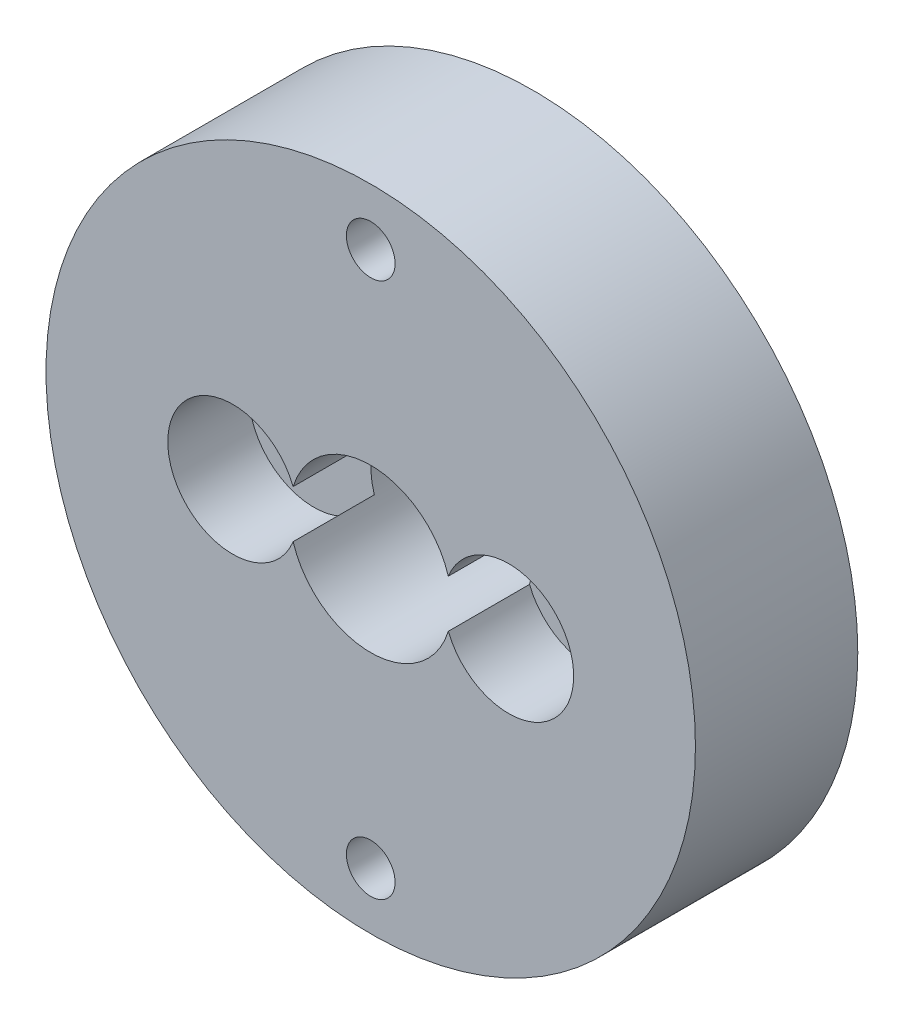
from build123d import *

# Parameters (mm, degrees)
SKETCH1_R           = 20
SKETCH1_R_2         = 1.25
SKETCH1_R_3         = 5
SKETCH1_R_4         = 1.5
BOSS_EXTRUDE1_DEPTH = 10
SKETCH2_R           = 4
CUT_EXTRUDE1_DEPTH  = 5


with BuildPart() as part:
    # Sketch1 → Boss-Extrude1 (new body)
    with BuildSketch(Plane.XY):
        Circle(SKETCH1_R)
        with Locations((-8.5, 0)):
            Circle(SKETCH1_R_2, mode=Mode.SUBTRACT)
        with Locations((8.5, 0)):
            Circle(SKETCH1_R_2, mode=Mode.SUBTRACT)
        Circle(SKETCH1_R_3, mode=Mode.SUBTRACT)
        with Locations((0, 16.5)):
            Circle(SKETCH1_R_4, mode=Mode.SUBTRACT)
        with Locations((0, -16.5)):
            Circle(SKETCH1_R_4, mode=Mode.SUBTRACT)
    extrude(amount=BOSS_EXTRUDE1_DEPTH)

    # Sketch2 → Cut-Extrude1 (cut)
    with BuildSketch(Plane.XY.offset(10)):
        with Locations((8.5, 0)):
            Circle(SKETCH2_R)
        with Locations((-8.5, 0)):
            Circle(SKETCH2_R)
    extrude(amount=-CUT_EXTRUDE1_DEPTH, mode=Mode.SUBTRACT)


solid = part.part
